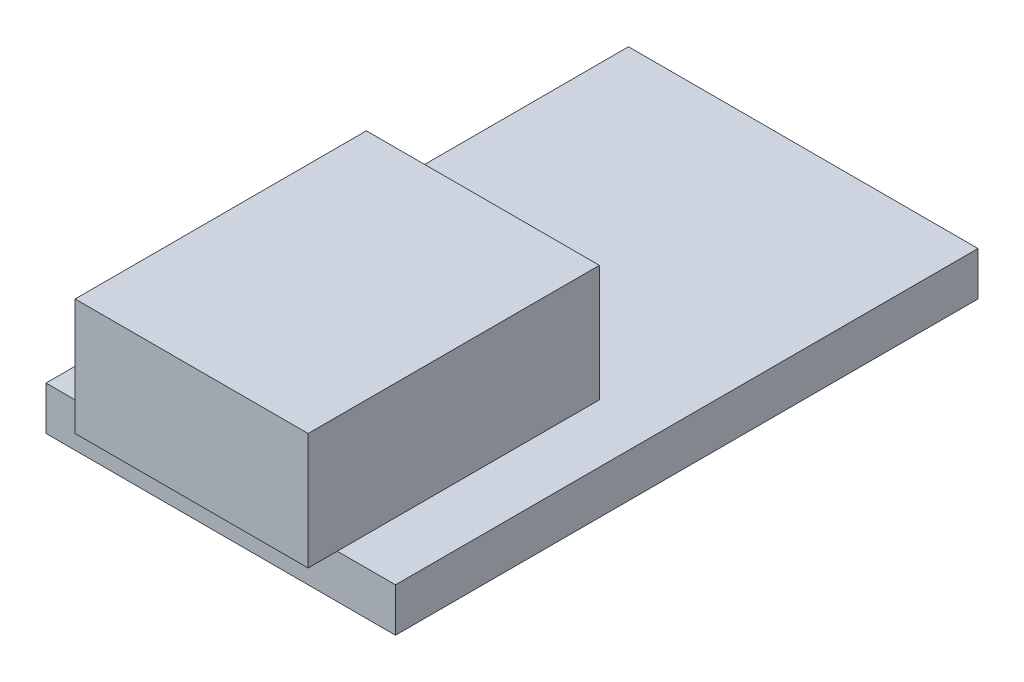
from build123d import *

# Parameters (mm, degrees)
SKETCH1_W           = 8
SKETCH1_H           = 10
BOSS_EXTRUDE1_DEPTH = 4
SKETCH2_W           = 12
SKETCH2_H           = 20
BOSS_EXTRUDE2_DEPTH = 1.5


with BuildPart() as part:
    # Sketch1 → Boss-Extrude1 (new body)
    with BuildSketch(Plane(origin=(0, 0, 0), x_dir=(1, 0, 0), z_dir=(0, 1, 0))):
        Rectangle(SKETCH1_W, SKETCH1_H)
    extrude(amount=BOSS_EXTRUDE1_DEPTH)

    # Sketch2 → Boss-Extrude2 (add)
    with BuildSketch(Plane.XZ):
        with Locations((0, -6)):
            Rectangle(SKETCH2_W, SKETCH2_H)
    extrude(amount=BOSS_EXTRUDE2_DEPTH)


solid = part.part
